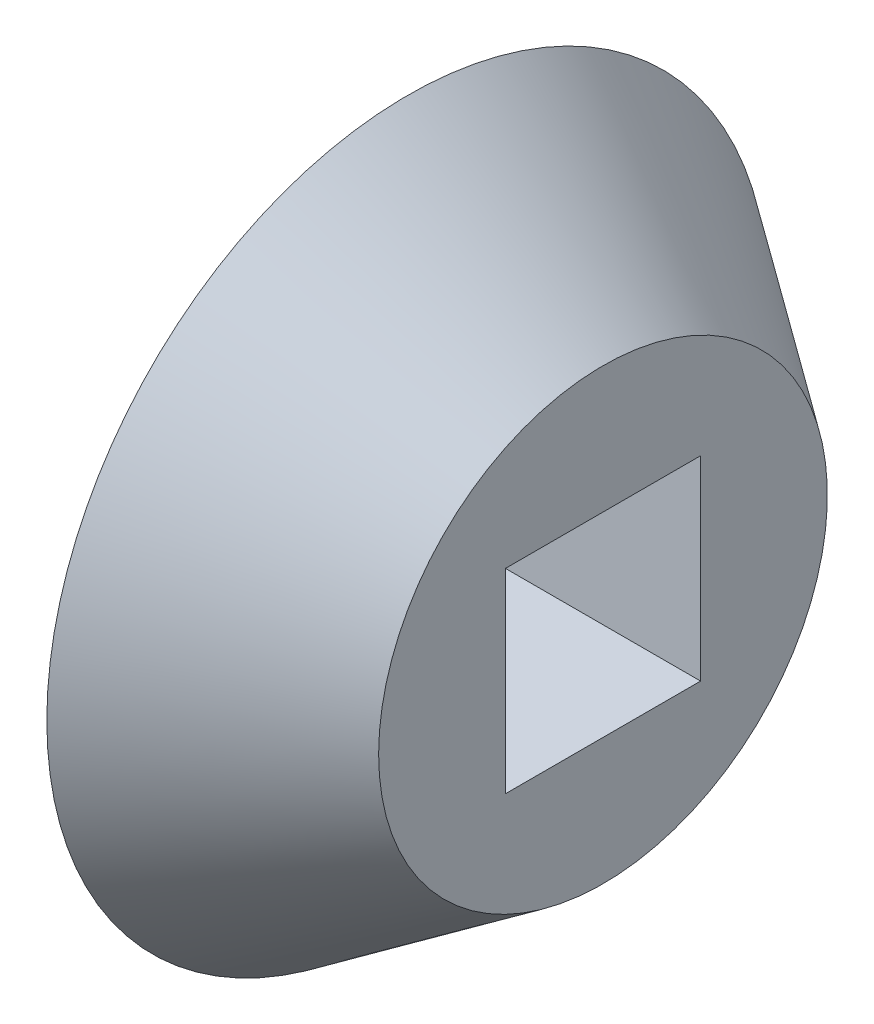
from build123d import *

# Parameters (mm, degrees)
SKETCH1_R           = 5.87375
SKETCH1_W           = 3.175
SKETCH1_H           = 3.175
BOSS_EXTRUDE1_DEPTH = 3.175


with BuildPart() as part:
    # Sketch1 → Boss-Extrude1 (new body)
    with BuildSketch(Plane(origin=(0, 0, 0), x_dir=(0, 0, -1), z_dir=(1, 0, 0))):
        Circle(SKETCH1_R)
        Rectangle(SKETCH1_W, SKETCH1_H, mode=Mode.SUBTRACT)
    extrude(amount=BOSS_EXTRUDE1_DEPTH)

    # Sketch2 → Cut-Revolve1 (revolve, cut)
    with BuildSketch(Plane.XY, mode=Mode.PRIVATE) as cut_revolve1_sk:
        Polygon((0, 5.87375), (3.175, 5.87375), (3.175, 3.650591066), align=None)
    revolve(cut_revolve1_sk.sketch.rotate(Axis((0, 0, 0), (1, 0, 0)), 90), axis=Axis((0, 0, 0), (1, 0, 0)), mode=Mode.SUBTRACT)


solid = part.part
